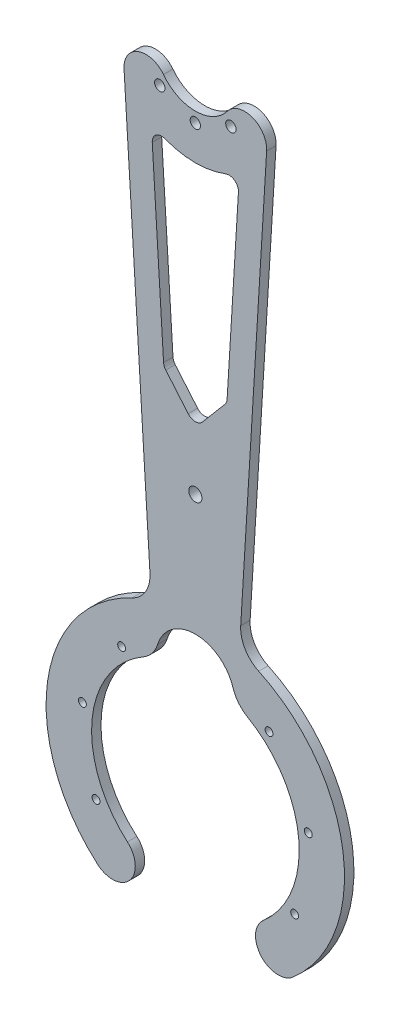
from build123d import *

# Parameters (mm, degrees)
SKETCH_1_R          = 1.65
EXTRUDE_1_DEPTH     = 3
CUT_EXTRUDE_2_DEPTH = 15
SKETCH_5_R          = 2.1
CUT_EXTRUDE_4_DEPTH = 10
SKETCH_7_R          = 1.25
CUT_EXTRUDE_5_DEPTH = 10


with BuildPart() as part:
    # 草图1 → 凸台-拉伸1 (new body)
    with BuildSketch(Plane.XY):
        with BuildLine():
            Line((-22.697635701, -12.395491404), (-14.442560568, -147.364776776))
            ThreePointArc((-14.442560568, -147.364776776), (-15.823949319, -153.078271204), (-20.176817783, -157.028561017))
            ThreePointArc((-20.176817783, -157.028561017), (-47.058743214, -193.524865403), (-31.100695855, -235.950787588))
            ThreePointArc((-31.100695855, -235.950787588), (-20.888265121, -235.217514211), (-21.621538498, -225.005083476))
            ThreePointArc((-21.621538498, -225.005083476), (-32.880043508, -196.919424149), (-16.54147024, -171.451616657))
            ThreePointArc((-16.54147024, -171.451616657), (-13.7328083, -169.032706132), (-11.998184018, -165.756917888))
            ThreePointArc((-11.998184018, -165.756917888), (-0.004609984, -156.91008357), (12.004108348, -165.736350029))
            ThreePointArc((12.004108348, -165.736350029), (13.740280131, -169.004081067), (16.545879515, -171.416749859))
            ThreePointArc((16.545879515, -171.416749859), (32.911643519, -196.909572863), (21.642742476, -225.029567981))
            ThreePointArc((21.642742476, -225.029567981), (20.912749625, -235.196310232), (31.079491877, -235.926303083))
            ThreePointArc((31.079491877, -235.926303083), (47.027386385, -193.534561527), (20.172667208, -157.062392008))
            ThreePointArc((20.172667208, -157.062392008), (15.821251847, -153.112090569), (14.440433304, -147.39955722))
            Line((14.440433304, -147.39955722), (22.697635701, -12.395491404))
            ThreePointArc((22.697635701, -12.395491404), (18.150671537, -5.407168438), (10.142345541, -7.726275101))
            ThreePointArc((10.142345541, -7.726275101), (0, -12.75), (-10.142345541, -7.726275101))
            ThreePointArc((-10.142345541, -7.726275101), (-18.150671537, -5.407168438), (-22.697635701, -12.395491404))
        make_face()
        with Locations((-11.313708499, -11.313708499)):
            Circle(SKETCH_1_R, mode=Mode.SUBTRACT)
        with Locations((0, -16)):
            Circle(SKETCH_1_R, mode=Mode.SUBTRACT)
        with Locations((11.313708499, -11.313708499)):
            Circle(SKETCH_1_R, mode=Mode.SUBTRACT)
    extrude(amount=EXTRUDE_1_DEPTH)

    # 草图4 → 切除-拉伸2 (cut)
    with BuildSketch(Plane(origin=(0, 0, 0), x_dir=(-1, 0, 0), z_dir=(0, 0, -1))):
        with BuildLine():
            Line((-13.715926625, -28.201870805), (-10.113702702, -87.097711346))
            ThreePointArc((-10.113702702, -87.097711346), (-9.904103863, -88.030297779), (-9.411801117, -88.849618921))
            Line((-9.411801117, -88.849618921), (-2.292502811, -97.284018261))
            ThreePointArc((-2.292502811, -97.284018261), (0, -98.348965067), (2.292502811, -97.284018261))
            Line((2.292502811, -97.284018261), (9.411801117, -88.849618921))
            ThreePointArc((9.411801117, -88.849618921), (9.904103863, -88.030297779), (10.113702702, -87.097711346))
            Line((10.113702702, -87.097711346), (13.715926625, -28.201870805))
            ThreePointArc((13.715926625, -28.201870805), (12.496725506, -25.600326268), (9.649370007, -25.216852668))
            ThreePointArc((9.649370007, -25.216852668), (0, -27), (-9.649370007, -25.216852668))
            ThreePointArc((-9.649370007, -25.216852668), (-12.496725506, -25.600326268), (-13.715926625, -28.201870805))
        make_face()
    extrude(amount=-CUT_EXTRUDE_2_DEPTH, mode=Mode.SUBTRACT)

    # 草图5 → 切除-拉伸4 (cut)
    with BuildSketch(Plane.XY.offset(3)):
        with Locations((0, -188.402692504)):
            Circle(SKETCH_5_R)
        with Locations((0, -118.402692504)):
            Circle(SKETCH_5_R)
    extrude(amount=-CUT_EXTRUDE_4_DEPTH, mode=Mode.SUBTRACT)

    # 草图7 → 切除-拉伸5 (cut)
    with BuildSketch(Plane.XY.offset(3)):
        with Locations((0, -163.538416724)):
            Circle(SKETCH_7_R)
        with Locations((23.461747754, -172.07779455)):
            Circle(SKETCH_7_R)
        with Locations((35.945482985, -193.700258239)):
            Circle(SKETCH_7_R)
        with Locations((31.609927238, -218.288416724)):
            Circle(SKETCH_7_R)
        with Locations((12.483735231, -234.337197383)):
            Circle(SKETCH_7_R)
        with Locations((-12.483735231, -234.337197383)):
            Circle(SKETCH_7_R)
        with Locations((-31.609927238, -218.288416724)):
            Circle(SKETCH_7_R)
        with Locations((-35.945482985, -193.700258239)):
            Circle(SKETCH_7_R)
        with Locations((-23.461747754, -172.07779455)):
            Circle(SKETCH_7_R)
    extrude(amount=-CUT_EXTRUDE_5_DEPTH, mode=Mode.SUBTRACT)


solid = part.part
